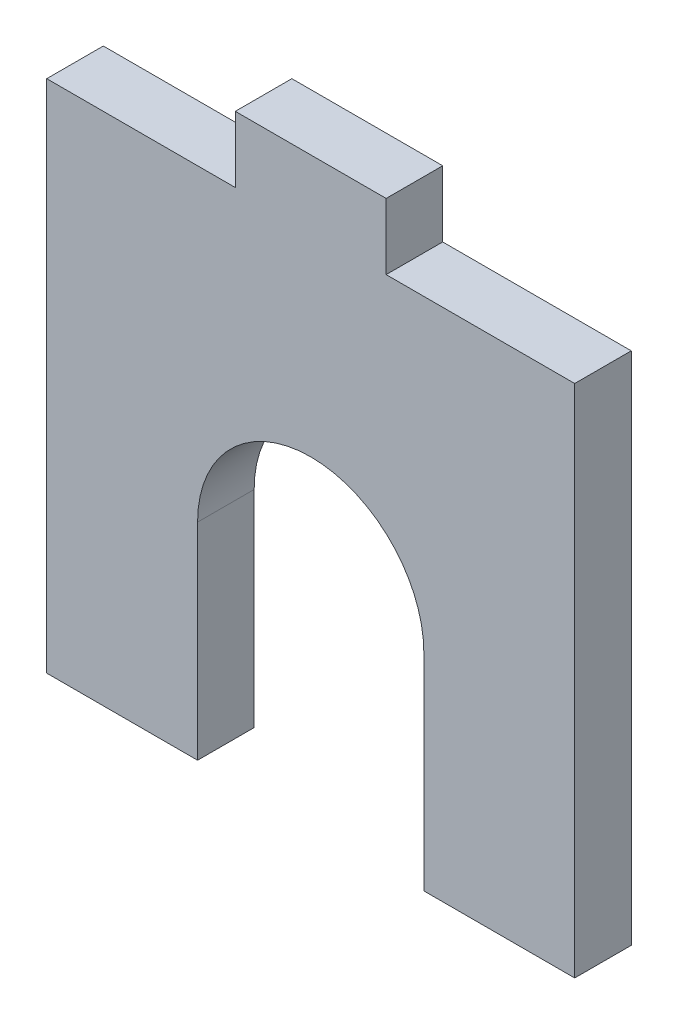
from build123d import *

# Parameters (mm, degrees)
RESSALTO_EXTRUS_O1_DEPTH = 3


with BuildPart() as part:
    # Esboço9 → Ressalto-extrusão1 (new body)
    with BuildSketch(Plane.XY):
        with BuildLine():
            Line((-14, -10.9375), (-6, -10.9375))
            Line((-6, -10.9375), (-6, 0))
            ThreePointArc((-6, 0), (0, 6), (6, 0))
            Line((6, 0), (6, -10.9375))
            Line((6, -10.9375), (14, -10.9375))
            Line((14, -10.9375), (14, 16.367680587))
            Line((14, 16.367680587), (4, 16.367680587))
            Line((4, 16.367680587), (4, 19.867680587))
            Line((4, 19.867680587), (-4, 19.867680587))
            Line((-4, 19.867680587), (-4, 16.367680587))
            Line((-4, 16.367680587), (-14, 16.367680587))
            Line((-14, 16.367680587), (-14, -10.9375))
        make_face()
    extrude(amount=RESSALTO_EXTRUS_O1_DEPTH)


solid = part.part
